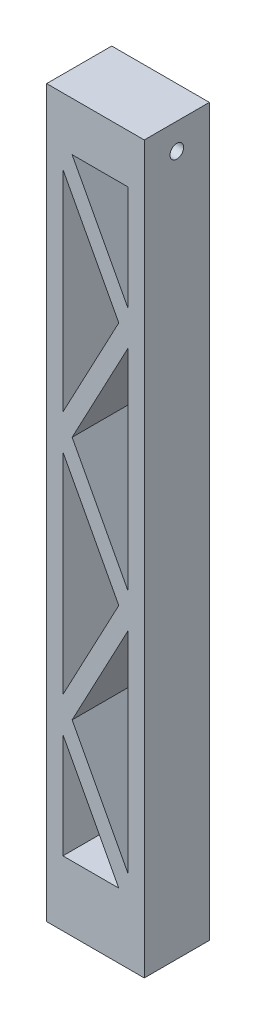
from build123d import *

# Parameters (mm, degrees)
SKETCH_1_W             = 30
SKETCH_1_H             = 20
EXTRUDE_1_DEPTH        = 223
CUT_EXTRUDE_1_DEPTH    = 225.396969677
HOLE_WIZARD_M5_1_D     = 4.2
HOLE_WIZARD_M5_1_DEPTH = 14
HOLE_WIZARD_M5_1_TIP   = 1.2618073
HOLE_WIZARD_M5_2_D     = 4.2


with BuildPart() as part:
    # 草图1 → 凸台-拉伸1 (new body)
    with BuildSketch(Plane(origin=(0, 0, 0), x_dir=(1, 0, 0), z_dir=(0, 1, 0))):
        Rectangle(SKETCH_1_W, SKETCH_1_H)
    extrude(amount=EXTRUDE_1_DEPTH)

    # 草图2 → 切除-拉伸1 (cut, through all)
    with BuildSketch(Plane.XY.offset(-10)):
        Polygon((7.168333691, 20), (-10, 20), (-10, 52.276467338), align=None)
        Polygon((10, 89.876467338), (-7.168333691, 57.6), (10, 25.323532662), align=None)
        Polygon((-10, 127.476467338), (-10, 62.923532662), (7.168333691, 95.2), align=None)
        Polygon((10, 165.076467338), (-7.168333691, 132.8), (10, 100.523532662), align=None)
        Polygon((-10, 202.676467338), (-10, 138.123532662), (7.168333691, 170.4), align=None)
        Polygon((-7.168333691, 208), (10, 208), (10, 175.723532662), align=None)
    extrude(amount=CUT_EXTRUDE_1_DEPTH, mode=Mode.SUBTRACT)

    # M5 螺纹孔1
    with Locations(Plane(origin=(0, 0, 0), x_dir=(-1, 0, 0), z_dir=(0, -1, 0))):
        with Locations((8, 0), (-8, 0)):
            Hole(HOLE_WIZARD_M5_1_D / 2, depth=HOLE_WIZARD_M5_1_DEPTH)
            with Locations((0, 0, -(HOLE_WIZARD_M5_1_DEPTH + HOLE_WIZARD_M5_1_TIP / 2))):  # 118° drill point
                Cone(0, HOLE_WIZARD_M5_1_D / 2, HOLE_WIZARD_M5_1_TIP, mode=Mode.SUBTRACT)

    # M5 螺纹孔2 (through all)
    with Locations(Plane(origin=(15, 0, 0), x_dir=(0, 0, -1), z_dir=(1, 0, 0))):
        with Locations((0, 215)):
            Hole(HOLE_WIZARD_M5_2_D / 2)


solid = part.part
